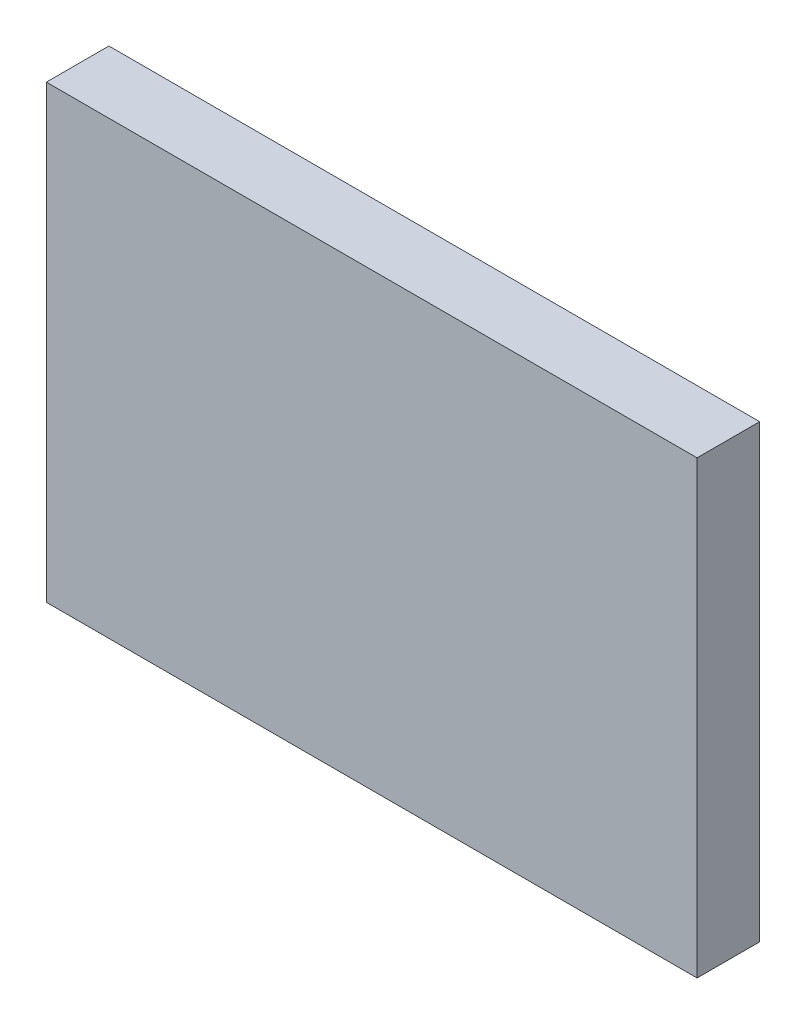
from build123d import *

# Parameters (mm, degrees)
SKETCH1_W           = 26
SKETCH1_H           = 2.5
BOSS_EXTRUDE1_DEPTH = 18


with BuildPart() as part:
    # Sketch1 → Boss-Extrude1 (new body)
    with BuildSketch(Plane(origin=(0, 0, 0), x_dir=(1, 0, 0), z_dir=(0, 1, 0))):
        with Locations((13, 1.25)):
            Rectangle(SKETCH1_W, SKETCH1_H)
    extrude(amount=BOSS_EXTRUDE1_DEPTH)


solid = part.part
